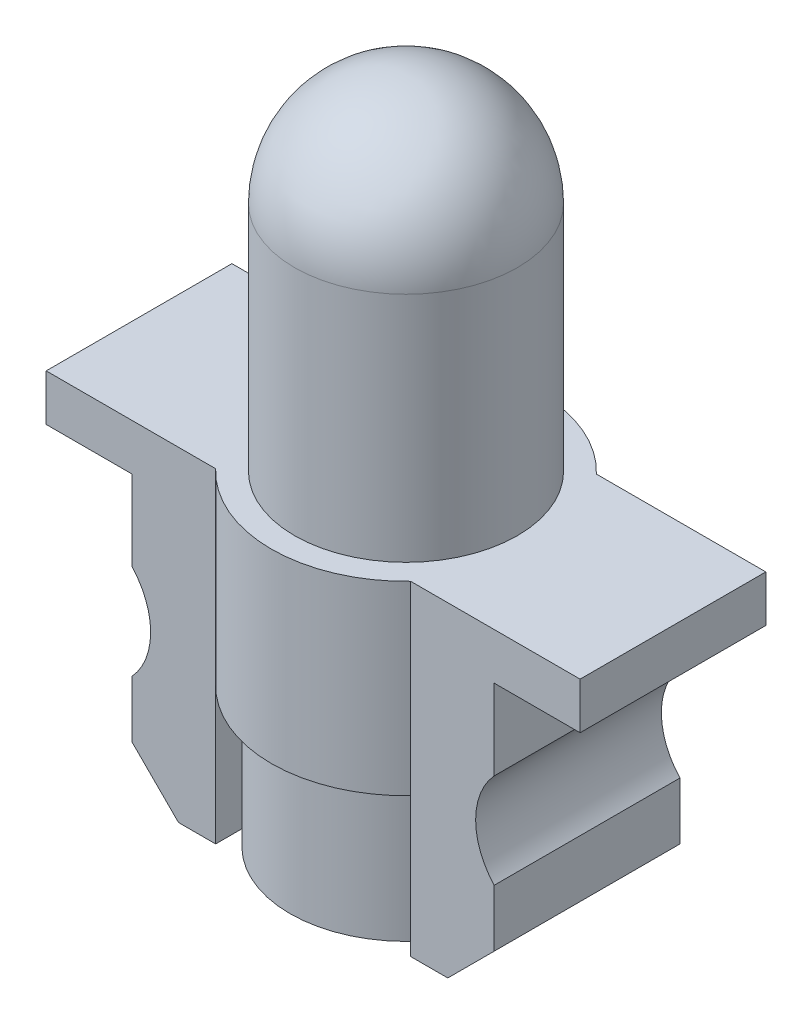
from build123d import *

# Parameters (mm, degrees)
SKETCH_1_W                  = 11.5
SKETCH_1_H                  = 4
EXTRUDE_1_DEPTH             = 1
SKETCH_2_R                  = 2.9
EXTRUDE_2_DEPTH             = 4
SKETCH_4_R                  = 2.5
EXTRUDE_3_DEPTH             = 3.6
EXTRUDE_4_REACH             = 11.962
SKETCH_5_W                  = 1.8
SKETCH_5_H                  = 6.6
EXTRUDE_4_DIRECTION_2_REACH = 11.962
CUT_EXTRUDE_1_DEPTH         = 10.961551084
CUT_EXTRUDE_1_DEPTH_BACK    = 10.961551084
SKETCH_6_R                  = 1.5
CUT_EXTRUDE_2_DEPTH         = 10.961551084
CUT_EXTRUDE_2_DEPTH_BACK    = 10.961551084
SKETCH_7_W                  = 7.8
SKETCH_7_H                  = 0.6
CHAMFER_1_SIZE              = 1


with BuildPart() as part:
    # 草图1 → 凸台-拉伸1 (new body)
    with BuildSketch(Plane(origin=(0, 0, 0), x_dir=(1, 0, 0), z_dir=(0, 1, 0))):
        Rectangle(SKETCH_1_W, SKETCH_1_H)
    extrude(amount=-EXTRUDE_1_DEPTH)

    # 草图2 → 凸台-拉伸2 (add)
    with BuildSketch(Plane(origin=(0, 0, 0), x_dir=(-1, 0, 0), z_dir=(0, 1, 0))):
        with Locations(Location((0, 0, 0), (0, 0, 90))):
            Circle(SKETCH_2_R)
    extrude(amount=-EXTRUDE_2_DEPTH)

    # 草图3 → 旋转1 (revolve)
    with BuildSketch(Plane.XY, mode=Mode.PRIVATE) as revolve_1_sk:
        with BuildLine():
            Line((0, 0), (2.4, 0))
            Line((2.4, 0), (2.4, 5))
            ThreePointArc((2.4, 5), (1.697056275, 6.697056275), (0, 7.4))
            Line((0, 7.4), (0, 0))
        make_face()
    revolve(revolve_1_sk.sketch.rotate(Axis((0, 7.945806113, 0), (0, -1, 0)), 90), axis=Axis((0, 7.945806113, 0), (0, -1, 0)))

    # 草图4 → 凸台-拉伸3 (add)
    with BuildSketch(Plane.XZ.offset(4)):
        with Locations(Location((0, 0, 0), (0, 0, 90))):
            Circle(SKETCH_4_R)
    extrude(amount=EXTRUDE_3_DEPTH)

    # 凸台-拉伸4: up to this face of the body (flat: up to its plane)
    extrude_4_end = Plane(part.part.faces().sort_by_distance((3.925, -0.5, -2))[0])
    # 草图5 → 凸台-拉伸4 (add, up to the picked face)
    with BuildSketch(Plane.XY, mode=Mode.PRIVATE) as extrude_4_sk1:
        with Locations((-3, -4.3)):
            Rectangle(SKETCH_5_W, SKETCH_5_H)
    extrude_4_tool1 = split(extrude(extrude_4_sk1.sketch, amount=-EXTRUDE_4_REACH, mode=Mode.PRIVATE), bisect_by=extrude_4_end, keep=Keep.BOTH, mode=Mode.PRIVATE)
    # 草图5 → 凸台-拉伸4 (add, up to the picked face)
    with BuildSketch(Plane.XY, mode=Mode.PRIVATE) as extrude_4_sk2:
        with Locations((3, -4.3)):
            Rectangle(SKETCH_5_W, SKETCH_5_H)
    extrude_4_tool2 = split(extrude(extrude_4_sk2.sketch, amount=-EXTRUDE_4_REACH, mode=Mode.PRIVATE), bisect_by=extrude_4_end, keep=Keep.BOTH, mode=Mode.PRIVATE)
    add(extrude_4_tool1.solids().sort_by(Axis((-3, -4.3, 0), (0, 0, -1)))[0])
    add(extrude_4_tool2.solids().sort_by(Axis((3, -4.3, 0), (0, 0, -1)))[0])

    # 凸台-拉伸4 direction 2: up to this face of the body (flat: up to its plane)
    extrude_4_direction_2_end = Plane(part.part.faces().sort_by_distance((3.925, -0.5, 2))[0])
    # 草图5 → 凸台-拉伸4 direction 2 (add, up to the picked face)
    with BuildSketch(Plane.XY, mode=Mode.PRIVATE) as extrude_4_direction_2_sk1:
        with Locations((-3, -4.3)):
            Rectangle(SKETCH_5_W, SKETCH_5_H)
    extrude_4_direction_2_tool1 = split(extrude(extrude_4_direction_2_sk1.sketch, amount=EXTRUDE_4_DIRECTION_2_REACH, mode=Mode.PRIVATE), bisect_by=extrude_4_direction_2_end, keep=Keep.BOTH, mode=Mode.PRIVATE)
    # 草图5 → 凸台-拉伸4 direction 2 (add, up to the picked face)
    with BuildSketch(Plane.XY, mode=Mode.PRIVATE) as extrude_4_direction_2_sk2:
        with Locations((3, -4.3)):
            Rectangle(SKETCH_5_W, SKETCH_5_H)
    extrude_4_direction_2_tool2 = split(extrude(extrude_4_direction_2_sk2.sketch, amount=EXTRUDE_4_DIRECTION_2_REACH, mode=Mode.PRIVATE), bisect_by=extrude_4_direction_2_end, keep=Keep.BOTH, mode=Mode.PRIVATE)
    add(extrude_4_direction_2_tool1.solids().sort_by(Axis((-3, -4.3, 0), (0, 0, 1)))[0])
    add(extrude_4_direction_2_tool2.solids().sort_by(Axis((3, -4.3, 0), (0, 0, 1)))[0])

    # 草图6 → 切除-拉伸1 (cut, two sides: drawn at the far end of the back side and taken through both)
    with BuildSketch(Plane.XY.offset(-CUT_EXTRUDE_1_DEPTH_BACK)):
        with Locations((-5, -3.75)):
            Circle(SKETCH_6_R)
        with Locations((5, -3.75)):
            Circle(SKETCH_6_R)
    extrude(amount=CUT_EXTRUDE_1_DEPTH + CUT_EXTRUDE_1_DEPTH_BACK, mode=Mode.SUBTRACT)

    # 草图7 → 切除-拉伸2 (cut, two sides: drawn at the far end of the back side and taken through both)
    with BuildSketch(Plane.XY.offset(-CUT_EXTRUDE_2_DEPTH_BACK)):
        with Locations((0, -7.3)):
            Rectangle(SKETCH_7_W, SKETCH_7_H)
    extrude(amount=CUT_EXTRUDE_2_DEPTH + CUT_EXTRUDE_2_DEPTH_BACK, mode=Mode.SUBTRACT)

    # 倒角1
    chamfer_1_edges = [part.edges().sort_by_distance(p)[0] for p in [
        (-3.9, -7, 0),
        (3.9, -7, 0),
    ]]
    chamfer(chamfer_1_edges, length=CHAMFER_1_SIZE)


solid = part.part
